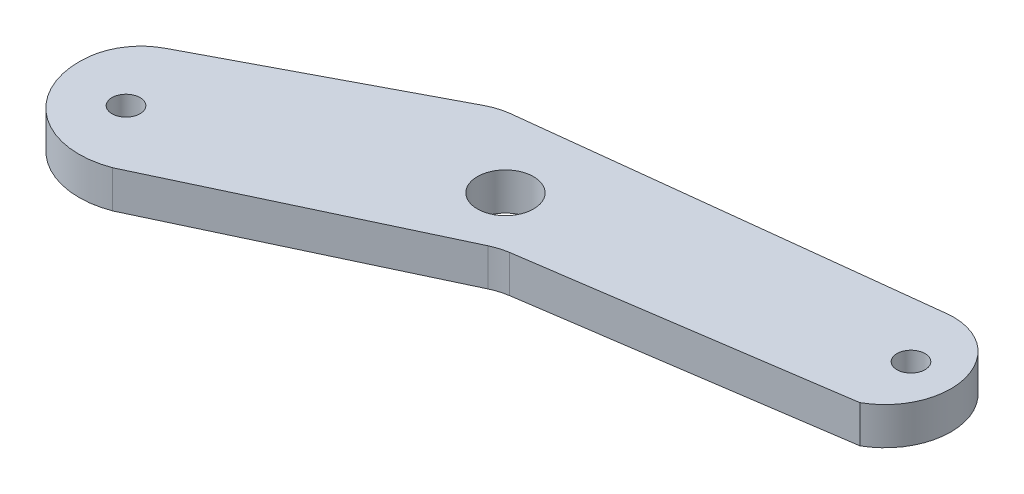
from build123d import *

# Parameters (mm, degrees)
CROQUIS1_R              = 2.38125
CROQUIS1_R_2            = 4.7625
SALIENTE_EXTRUIR1_DEPTH = 6.35


with BuildPart() as part:
    # Croquis1 → Saliente-Extruir1 (new body)
    with BuildSketch(Plane(origin=(0, 0, 0), x_dir=(1, 0, 0), z_dir=(0, 1, 0))):
        with BuildLine():
            Line((84.213215594, 2.393454749), (32.410165231, -5.256154194))
            ThreePointArc((32.410165231, -5.256154194), (30.980948086, -5.575600872), (29.613714015, -6.100366364))
            Line((29.613714015, -6.100366364), (-13.707132326, -26.482618703))
            ThreePointArc((-13.707132326, -26.482618703), (-26.984336102, -24.417368961), (-32.012638404, -11.956808276))
            ThreePointArc((-32.012638404, -11.956808276), (-30.297252372, -7.553267867), (-26.751302562, -4.429174828))
            Line((-26.751302562, -4.429174828), (8.61159414, 14.14717195))
            ThreePointArc((8.61159414, 14.14717195), (10.316229022, 14.850568011), (12.121038164, 15.228999065))
            Line((12.121038164, 15.228999065), (78.485256883, 22.851064868))
            ThreePointArc((78.485256883, 22.851064868), (83.263691234, 22.231373752), (87.197610529, 19.448977141))
            ThreePointArc((87.197610529, 19.448977141), (89.746766231, 10.214055317), (84.213215594, 2.393454749))
        make_face()
        with Locations(Location((82.534463123, 12.758385533, 0), (0, 0, 270))):
            Circle(CROQUIS1_R, mode=Mode.SUBTRACT)
        with Locations(Location((23.306287218, 3.165514271, 0), (0, 0, 270))):
            Circle(CROQUIS1_R_2, mode=Mode.SUBTRACT)
        with Locations(Location((-21.693712782, -16.225205159, 0), (0, 0, 270))):
            Circle(CROQUIS1_R, mode=Mode.SUBTRACT)
    extrude(amount=SALIENTE_EXTRUIR1_DEPTH)


solid = part.part
